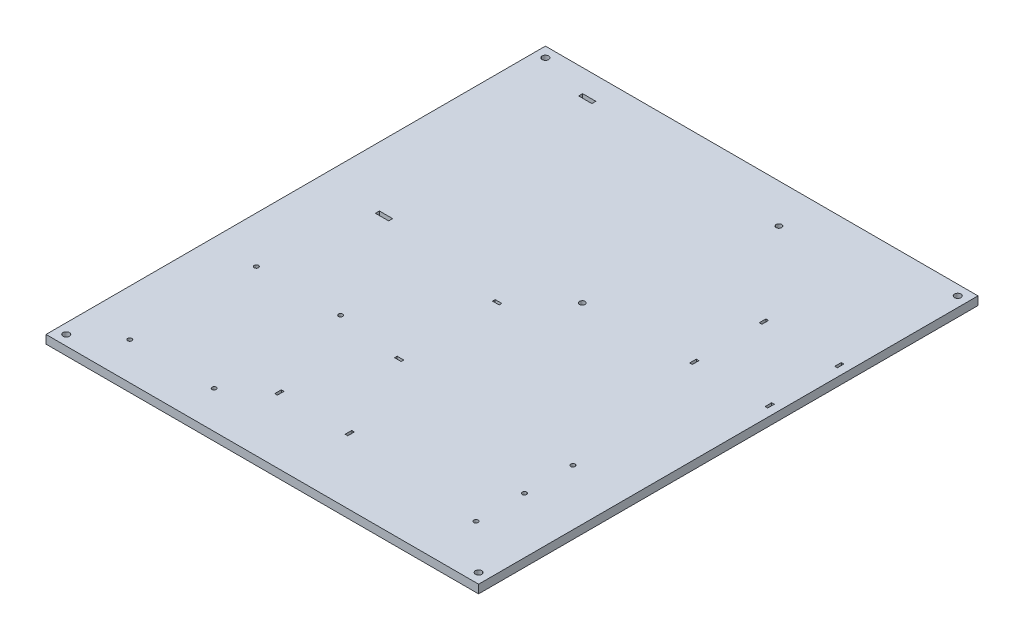
from build123d import *

# Parameters (mm, degrees)
SKETCH1_W      = 325.7
SKETCH1_H      = 376
SKETCH1_R      = 2.413
SKETCH1_R_2    = 2.0828
SKETCH1_R_3    = 1.5875
SKETCH1_R_4    = 1.6256
SKETCH1_W_2    = 10
SKETCH1_H_2    = 3
SKETCH1_W_3    = 5
SKETCH1_H_3    = 2
SKETCH1_W_4    = 2
SKETCH1_H_4    = 5
EXTRUDE1_DEPTH = 6.35


with BuildPart() as part:
    # Sketch1 → Extrude1 (new body)
    with BuildSketch(Plane(origin=(0, 0, 0), x_dir=(1, 0, 0), z_dir=(0, 1, 0))):
        with Locations((162.85, 188)):
            Rectangle(SKETCH1_W, SKETCH1_H)
        with Locations(Location((7.62, 368.38, 0), (0, 0, 270))):
            Circle(SKETCH1_R, mode=Mode.SUBTRACT)
        with Locations(Location((205.238, 346.5828, 0), (0, 0, 270))):
            Circle(SKETCH1_R_2, mode=Mode.SUBTRACT)
        with Locations(Location((181.362, 222.4172, 0), (0, 0, 270))):
            Circle(SKETCH1_R_2, mode=Mode.SUBTRACT)
        with Locations(Location((318.08, 368.38, 0), (0, 0, 270))):
            Circle(SKETCH1_R, mode=Mode.SUBTRACT)
        with Locations(Location((7.62, 7.62, 0), (0, 0, 270))):
            Circle(SKETCH1_R, mode=Mode.SUBTRACT)
        with Locations(Location((318.08, 7.62, 0), (0, 0, 270))):
            Circle(SKETCH1_R, mode=Mode.SUBTRACT)
        with Locations(Location((34.925, 123.425, 0), (0, 0, 270))):
            Circle(SKETCH1_R_3, mode=Mode.SUBTRACT)
        with Locations(Location((98.425, 123.425, 0), (0, 0, 270))):
            Circle(SKETCH1_R_3, mode=Mode.SUBTRACT)
        with Locations(Location((34.925, 28.175104068, 0), (0, 0, 270))):
            Circle(SKETCH1_R_3, mode=Mode.SUBTRACT)
        with Locations(Location((98.425, 28.175104068, 0), (0, 0, 270))):
            Circle(SKETCH1_R_3, mode=Mode.SUBTRACT)
        with Locations(Location((283.7, 113, 0), (0, 0, 270))):
            Circle(SKETCH1_R_4, mode=Mode.SUBTRACT)
        with Locations(Location((283.7, 40, 0), (0, 0, 270))):
            Circle(SKETCH1_R_4, mode=Mode.SUBTRACT)
        with Locations(Location((283.7, 76.5, 0), (0, 0, 270))):
            Circle(SKETCH1_R_4, mode=Mode.SUBTRACT)
        with Locations((50, 204.5)):
            Rectangle(SKETCH1_W_2, SKETCH1_H_2, mode=Mode.SUBTRACT)
        with Locations((50, 357.5)):
            Rectangle(SKETCH1_W_2, SKETCH1_H_2, mode=Mode.SUBTRACT)
        with Locations((148.88, 190.8)):
            Rectangle(SKETCH1_W_3, SKETCH1_H_3, mode=Mode.SUBTRACT)
        with Locations((148.88, 117)):
            Rectangle(SKETCH1_W_3, SKETCH1_H_3, mode=Mode.SUBTRACT)
        with Locations((125.7, 50)):
            Rectangle(SKETCH1_W_4, SKETCH1_H_4, mode=Mode.SUBTRACT)
        with Locations((178.7, 50)):
            Rectangle(SKETCH1_W_4, SKETCH1_H_4, mode=Mode.SUBTRACT)
        with Locations((318.7, 226.19375)):
            Rectangle(SKETCH1_W_4, SKETCH1_H_4, mode=Mode.SUBTRACT)
        with Locations((261.9, 226.19375)):
            Rectangle(SKETCH1_W_4, SKETCH1_H_4, mode=Mode.SUBTRACT)
        with Locations((318.7, 278.58125)):
            Rectangle(SKETCH1_W_4, SKETCH1_H_4, mode=Mode.SUBTRACT)
        with Locations((261.9, 278.58125)):
            Rectangle(SKETCH1_W_4, SKETCH1_H_4, mode=Mode.SUBTRACT)
    extrude(amount=EXTRUDE1_DEPTH)


solid = part.part
